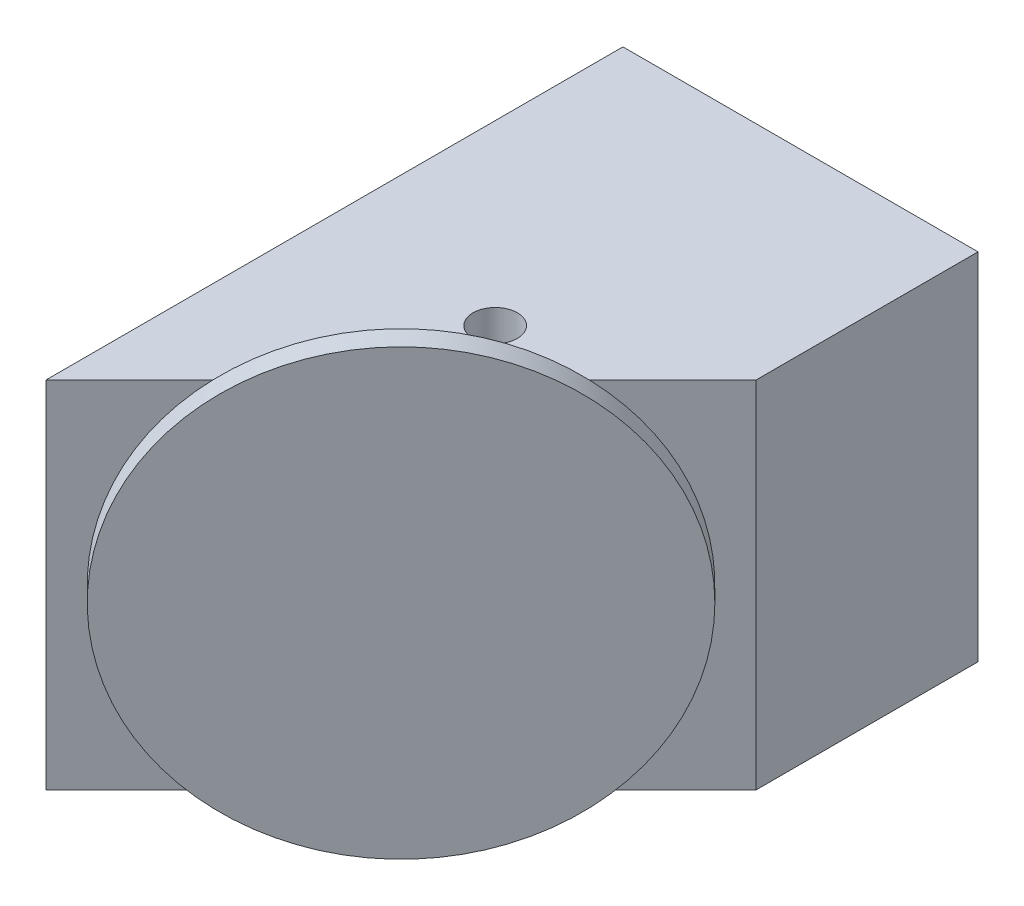
from build123d import *

# Parameters (mm, degrees)
SKETCH_1_W          = 16
SKETCH_1_H          = 16
SKETCH_1_W_2        = 10
SKETCH_1_H_2        = 10
EXTRUDE_1_DEPTH     = 10
EXTRUDE_2_DEPTH     = 16
EXTRUDE_3_DEPTH     = 1
CUT_EXTRUDE_3_DEPTH = 16


with BuildPart() as part:
    # 草图1 → 凸台-拉伸1 (new body)
    with BuildSketch(Plane.XY):
        with Locations((8, 8)):
            Rectangle(SKETCH_1_W, SKETCH_1_H)
        with Locations((8, 8)):
            Rectangle(SKETCH_1_W_2, SKETCH_1_H_2, mode=Mode.SUBTRACT)
    extrude(amount=EXTRUDE_1_DEPTH)

    # 草图2 → 凸台-拉伸2 (add)
    with BuildSketch(Plane.XZ):
        Polygon((0, 10), (0, 26), (16, 10), align=None)
    extrude(amount=-EXTRUDE_2_DEPTH)

    # 草图6 → 凸台-拉伸3 (add)
    with BuildSketch(Plane(origin=(13, 0, 13), x_dir=(0.7071067811865475, 0, -0.7071067811865477), z_dir=(0.7071067811865477, 0, 0.7071067811865475))):
        with BuildLine():
            Line((-13.071067812, 0), (-7.071067812, 0))
            Line((-7.071067812, 0), (-7.071067812, 16))
            Line((-7.071067812, 16), (-13.071067812, 16))
            ThreePointArc((-13.071067812, 16), (-17.071067812, 8), (-13.071067812, 0))
        make_face()
        with BuildLine():
            Line((-7.071067812, 16), (-7.071067812, 0))
            Line((-7.071067812, 0), (-1.071067812, 0))
            ThreePointArc((-1.071067812, 0), (1.873204098, 3.527864045), (2.928932188, 8))
            ThreePointArc((2.928932188, 8), (1.873204098, 12.472135955), (-1.071067812, 16))
            Line((-1.071067812, 16), (-7.071067812, 16))
        make_face()
        with BuildLine():
            Line((-1.071067812, 0), (-7.071067812, 0))
            Line((-7.071067812, 0), (-13.071067812, 0))
            ThreePointArc((-13.071067812, 0), (-7.071067812, -2), (-1.071067812, 0))
        make_face()
        with BuildLine():
            Line((-13.071067812, 16), (-7.071067812, 16))
            Line((-7.071067812, 16), (-1.071067812, 16))
            ThreePointArc((-1.071067812, 16), (-7.071067812, 18), (-13.071067812, 16))
        make_face()
    extrude(amount=EXTRUDE_3_DEPTH)

    # 草图9 → 切除-拉伸3 (cut)
    with BuildSketch(Plane(origin=(0, 0, 0), x_dir=(-1, 0, 0), z_dir=(0, -1, 0))):
        with BuildLine():
            Line((-8, -13.757359313), (-7.292893219, -14.464466094))
            ThreePointArc((-7.292893219, -14.464466094), (-7.076120467, -14.140042745), (-7, -13.757359313))
            ThreePointArc((-7, -13.757359313), (-7.292893219, -13.050252532), (-8, -12.757359313))
            Line((-8, -12.757359313), (-8, -13.757359313))
        make_face()
        with BuildLine():
            Line((-8.707106781, -13.050252532), (-8, -13.757359313))
            Line((-8, -13.757359313), (-8, -12.757359313))
            ThreePointArc((-8, -12.757359313), (-8.382683432, -12.83347978), (-8.707106781, -13.050252532))
        make_face()
        with BuildLine():
            ThreePointArc((-8.707106781, -13.050252532), (-8.707106781, -14.464466094), (-7.292893219, -14.464466094))
            Line((-7.292893219, -14.464466094), (-8, -13.757359313))
            Line((-8, -13.757359313), (-8.707106781, -13.050252532))
        make_face()
    extrude(amount=-CUT_EXTRUDE_3_DEPTH, mode=Mode.SUBTRACT)


solid = part.part
